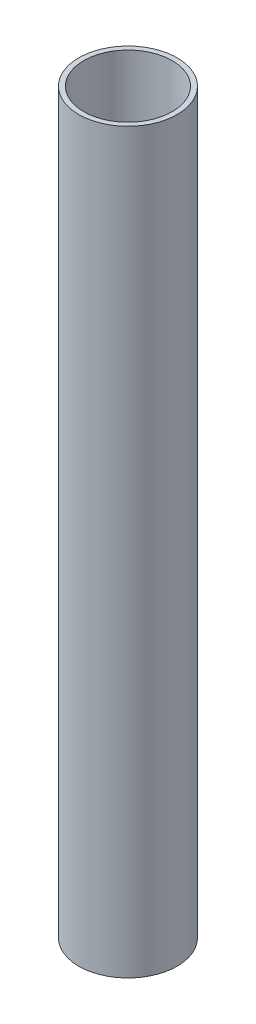
from build123d import *

# Parameters (mm, degrees)
SKETCH1_R           = 10
SKETCH1_R_2         = 9
BOSS_EXTRUDE1_DEPTH = 150


with BuildPart() as part:
    # Sketch1 → Boss-Extrude1 (new body)
    with BuildSketch(Plane(origin=(0, 0, 0), x_dir=(1, 0, 0), z_dir=(0, 1, 0))):
        with Locations(Location((0, 0, 0), (0, 0, 270))):
            Circle(SKETCH1_R)
        with Locations(Location((0, 0, 0), (0, 0, 270))):
            Circle(SKETCH1_R_2, mode=Mode.SUBTRACT)
    extrude(amount=BOSS_EXTRUDE1_DEPTH)


solid = part.part
